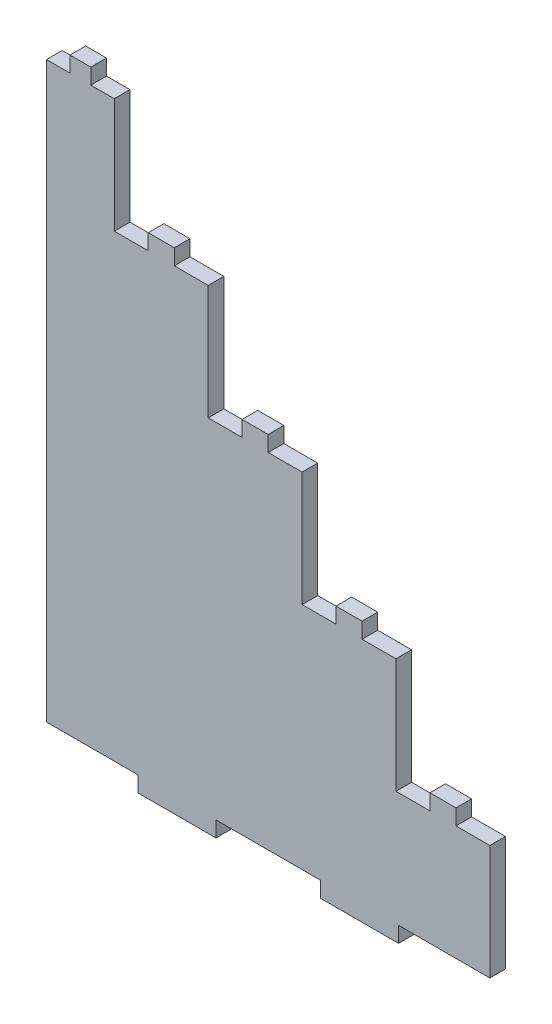
from build123d import *

# Parameters (mm, degrees)
BOSS_EXTRU_1_DEPTH = 6
ESQUISSE2_W        = 30
ESQUISSE2_H        = 6
BOSS_EXTRU_2_DEPTH = 6
ESQUISSE3_W        = 8
ESQUISSE3_H        = 6
BOSS_EXTRU_3_DEPTH = 6
ESQUISSE4_W        = 10
ESQUISSE4_H        = 6
BOSS_EXTRU_4_DEPTH = 6
ESQUISSE5_W        = 10
ESQUISSE5_H        = 6
BOSS_EXTRU_5_DEPTH = 6
ESQUISSE6_W        = 10
ESQUISSE6_H        = 6
BOSS_EXTRU_6_DEPTH = 6
ESQUISSE7_W        = 10
ESQUISSE7_H        = 6
BOSS_EXTRU_7_DEPTH = 6


with BuildPart() as part:
    # Esquisse1 → Boss.-Extru.1 (new body)
    with BuildSketch(Plane.XY):
        Polygon((0, 220), (26, 220), (26, 176), (62, 176), (62, 132), (98, 132), (98, 88), (134, 88), (134, 44), (170, 44), (170, 0), (0, 0), align=None)
    extrude(amount=BOSS_EXTRU_1_DEPTH)

    # Esquisse2 → Boss.-Extru.2 (add)
    with BuildSketch(Plane.XZ):
        with Locations((50, 3)):
            Rectangle(ESQUISSE2_W, ESQUISSE2_H)
        with Locations((120, 3)):
            Rectangle(ESQUISSE2_W, ESQUISSE2_H)
    extrude(amount=BOSS_EXTRU_2_DEPTH)

    # Esquisse3 → Boss.-Extru.3 (add)
    with BuildSketch(Plane(origin=(0, 220, 0), x_dir=(1, 0, 0), z_dir=(0, 1, 0))):
        with Locations((13, -3)):
            Rectangle(ESQUISSE3_W, ESQUISSE3_H)
    extrude(amount=BOSS_EXTRU_3_DEPTH)

    # Esquisse4 → Boss.-Extru.4 (add)
    with BuildSketch(Plane(origin=(0, 176, 0), x_dir=(1, 0, 0), z_dir=(0, 1, 0))):
        with Locations((44, -3)):
            Rectangle(ESQUISSE4_W, ESQUISSE4_H)
    extrude(amount=BOSS_EXTRU_4_DEPTH)

    # Esquisse5 → Boss.-Extru.5 (add)
    with BuildSketch(Plane(origin=(0, 132, 0), x_dir=(1, 0, 0), z_dir=(0, 1, 0))):
        with Locations((80, -3)):
            Rectangle(ESQUISSE5_W, ESQUISSE5_H)
    extrude(amount=BOSS_EXTRU_5_DEPTH)

    # Esquisse6 → Boss.-Extru.6 (add)
    with BuildSketch(Plane(origin=(0, 88, 0), x_dir=(1, 0, 0), z_dir=(0, 1, 0))):
        with Locations((116, -3)):
            Rectangle(ESQUISSE6_W, ESQUISSE6_H)
    extrude(amount=BOSS_EXTRU_6_DEPTH)

    # Esquisse7 → Boss.-Extru.7 (add)
    with BuildSketch(Plane(origin=(0, 44, 0), x_dir=(1, 0, 0), z_dir=(0, 1, 0))):
        with Locations((152, -3)):
            Rectangle(ESQUISSE7_W, ESQUISSE7_H)
    extrude(amount=BOSS_EXTRU_7_DEPTH)


solid = part.part
